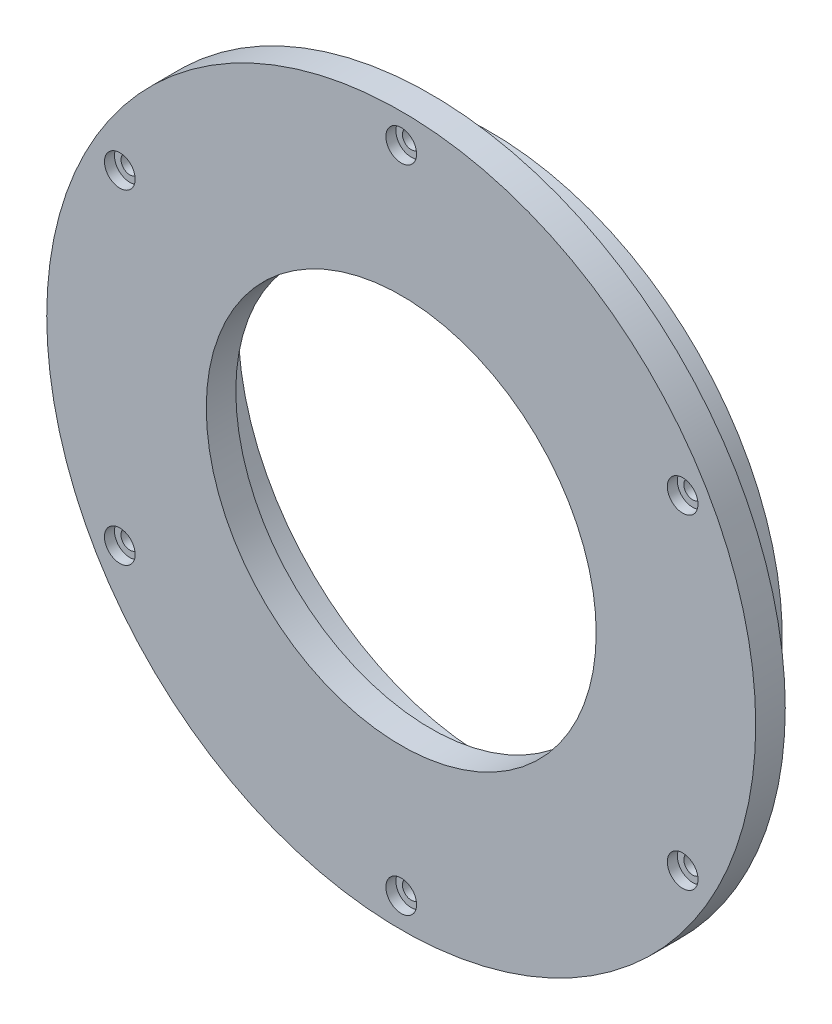
from build123d import *

# Parameters (mm, degrees)
SKETCH1_R                                            = 60
SKETCH1_R_2                                          = 33
BOSS_EXTRUDE1_DEPTH                                  = 5
SKETCH2_R                                            = 49.5
SKETCH2_R_2                                          = 42.6
BOSS_EXTRUDE2_DEPTH                                  = 10
SKETCH3_R                                            = 1.7
CUT_EXTRUDE1_DEPTH                                   = 5
SKETCH5_R                                            = 1.5
CUT_EXTRUDE2_DEPTH                                   = 5
CBORE_FOR_M5_HEX_SOCKET_THIN_HEAD_CAP_SC_D           = 3
CBORE_FOR_M5_HEX_SOCKET_THIN_HEAD_CAP_SC_CBORE_D     = 5.2
CBORE_FOR_M5_HEX_SOCKET_THIN_HEAD_CAP_SC_CBORE_DEPTH = 1.7


with BuildPart() as part:
    # Sketch1 → Boss-Extrude1 (new body)
    with BuildSketch(Plane.XY):
        Circle(SKETCH1_R)
        Circle(SKETCH1_R_2, mode=Mode.SUBTRACT)
    extrude(amount=BOSS_EXTRUDE1_DEPTH)

    # Sketch2 → Boss-Extrude2 (add)
    with BuildSketch(Plane(origin=(0, 0, 0), x_dir=(-1, 0, 0), z_dir=(0, 0, -1))):
        Circle(SKETCH2_R)
        Circle(SKETCH2_R_2, mode=Mode.SUBTRACT)
    extrude(amount=BOSS_EXTRUDE2_DEPTH)

    # Sketch3 → Cut-Extrude1 (cut)
    with BuildSketch(Plane(origin=(0, 0, -10), x_dir=(-1, 0, 0), z_dir=(0, 0, -1))):
        with Locations((0, 45)):
            Circle(SKETCH3_R)
        with Locations((5.52997308, 44.658922935)):
            Circle(SKETCH3_R)
        with Locations((10.976117405, 43.640862122)):
            Circle(SKETCH3_R)
        with Locations((16.255874978, 41.961250323)):
            Circle(SKETCH3_R)
        with Locations((21.289210058, 39.645548743)):
            Circle(SKETCH3_R)
        with Locations((25.999822413, 36.728861056)):
            Circle(SKETCH3_R)
        with Locations((30.316303964, 33.255401275)):
            Circle(SKETCH3_R)
        with Locations((34.173221249, 29.277823509)):
            Circle(SKETCH3_R)
        with Locations((37.512107335, 24.856423783)):
            Circle(SKETCH3_R)
        with Locations((40.282348111, 20.05822601)):
            Circle(SKETCH3_R)
        with Locations((42.441949551, 14.955965977)):
            Circle(SKETCH3_R)
        with Locations((43.958174299, 9.626988744)):
            Circle(SKETCH3_R)
        with Locations((44.808037933, 4.152076176)):
            Circle(SKETCH3_R)
        with Locations((44.978657387, -1.385777635)):
            Circle(SKETCH3_R)
        with Locations((44.467446244, -6.90262447)):
            Circle(SKETCH3_R)
        with Locations((43.282153943, -12.314834553)):
            Circle(SKETCH3_R)
        with Locations((41.440748308, -17.540364298)):
            Circle(SKETCH3_R)
        with Locations((38.97114317, -22.5)):
            Circle(SKETCH3_R)
        with Locations((35.910775228, -27.118558637)):
            Circle(SKETCH3_R)
        with Locations((32.306036538, -31.326027568)):
            Circle(SKETCH3_R)
        with Locations((28.211571265, -35.058625854)):
            Circle(SKETCH3_R)
        with Locations((23.689447329, -38.259771108)):
            Circle(SKETCH3_R)
        with Locations((18.80821552, -40.880937232)):
            Circle(SKETCH3_R)
        with Locations((13.641870335, -42.882390019)):
            Circle(SKETCH3_R)
        with Locations((8.268728302, -44.233789486)):
            Circle(SKETCH3_R)
        with Locations((2.770240776, -44.914649793)):
            Circle(SKETCH3_R)
        with Locations((-2.770240776, -44.914649793)):
            Circle(SKETCH3_R)
        with Locations((-8.268728302, -44.233789486)):
            Circle(SKETCH3_R)
        with Locations((-13.641870335, -42.882390019)):
            Circle(SKETCH3_R)
        with Locations((-18.80821552, -40.880937232)):
            Circle(SKETCH3_R)
        with Locations((-23.689447329, -38.259771108)):
            Circle(SKETCH3_R)
        with Locations((-28.211571265, -35.058625854)):
            Circle(SKETCH3_R)
        with Locations((-32.306036538, -31.326027568)):
            Circle(SKETCH3_R)
        with Locations((-35.910775228, -27.118558637)):
            Circle(SKETCH3_R)
        with Locations((-38.97114317, -22.5)):
            Circle(SKETCH3_R)
        with Locations((-41.440748308, -17.540364298)):
            Circle(SKETCH3_R)
        with Locations((-43.282153943, -12.314834553)):
            Circle(SKETCH3_R)
        with Locations((-44.467446244, -6.90262447)):
            Circle(SKETCH3_R)
        with Locations((-44.978657387, -1.385777635)):
            Circle(SKETCH3_R)
        with Locations((-44.808037933, 4.152076176)):
            Circle(SKETCH3_R)
        with Locations((-43.958174299, 9.626988744)):
            Circle(SKETCH3_R)
        with Locations((-42.441949551, 14.955965977)):
            Circle(SKETCH3_R)
        with Locations((-40.282348111, 20.05822601)):
            Circle(SKETCH3_R)
        with Locations((-37.512107335, 24.856423783)):
            Circle(SKETCH3_R)
        with Locations((-34.173221249, 29.277823509)):
            Circle(SKETCH3_R)
        with Locations((-30.316303964, 33.255401275)):
            Circle(SKETCH3_R)
        with Locations((-25.999822413, 36.728861056)):
            Circle(SKETCH3_R)
        with Locations((-21.289210058, 39.645548743)):
            Circle(SKETCH3_R)
        with Locations((-16.255874978, 41.961250323)):
            Circle(SKETCH3_R)
        with Locations((-10.976117405, 43.640862122)):
            Circle(SKETCH3_R)
        with Locations((-5.52997308, 44.658922935)):
            Circle(SKETCH3_R)
    extrude(amount=-CUT_EXTRUDE1_DEPTH, mode=Mode.SUBTRACT)

    # Sketch5 → Cut-Extrude2 (cut)
    with BuildSketch(Plane.XY.offset(5)):
        with Locations((0, 55)):
            Circle(SKETCH5_R)
        with Locations((47.631397208, 27.5)):
            Circle(SKETCH5_R)
        with Locations((47.631397208, -27.5)):
            Circle(SKETCH5_R)
        with Locations((0, -55)):
            Circle(SKETCH5_R)
        with Locations((-47.631397208, -27.5)):
            Circle(SKETCH5_R)
        with Locations((-47.631397208, 27.5)):
            Circle(SKETCH5_R)
    extrude(amount=-CUT_EXTRUDE2_DEPTH, mode=Mode.SUBTRACT)

    # CBORE for M5 Hex Socket Thin Head Cap Screw4 (through all)
    with Locations(Plane(origin=(-47.631397208, 27.5, 5), x_dir=(1, 0, 0), z_dir=(0, 0, 1))):
        with Locations((0, 0), (47.631397208, 27.5), (95.262794416, 0), (95.262794416, -55), (47.631397208, -82.5), (0, -55)):
            CounterBoreHole(CBORE_FOR_M5_HEX_SOCKET_THIN_HEAD_CAP_SC_D / 2, CBORE_FOR_M5_HEX_SOCKET_THIN_HEAD_CAP_SC_CBORE_D / 2, CBORE_FOR_M5_HEX_SOCKET_THIN_HEAD_CAP_SC_CBORE_DEPTH)


solid = part.part
